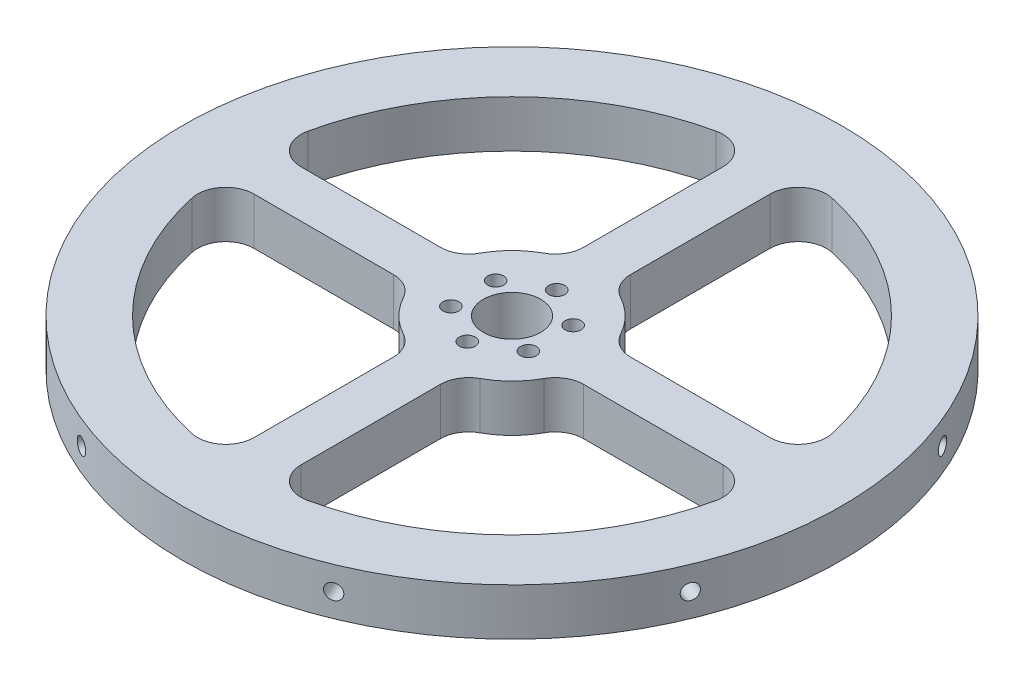
from build123d import *

# Parameters (mm, degrees)
SKETCH2_R           = 70
BOSS_EXTRUDE1_DEPTH = 5
CUT_EXTRUDE1_DEPTH  = 10
SKETCH6_R           = 6.1
CUT_EXTRUDE3_DEPTH  = 100.498743711
SKETCH7_R           = 1.7
CUT_EXTRUDE4_DEPTH  = 100.498743711
FILLET1_R           = 6
SKETCH10_R          = 1.65
CUT_EXTRUDE5_DEPTH  = 10
CIRPATTERN2_COUNT   = 8


with BuildPart() as part:
    # Sketch2 → Boss-Extrude1 (new, symmetric)
    with BuildSketch(Plane(origin=(0, 0, 0), x_dir=(1, 0, 0), z_dir=(0, 1, 0))):
        Circle(SKETCH2_R)
    extrude(amount=BOSS_EXTRUDE1_DEPTH, both=True)

    # Sketch3 → Cut-Extrude1 (cut)
    with BuildSketch(Plane(origin=(0, 5, 0), x_dir=(1, 0, 0), z_dir=(0, 1, 0))):
        with BuildLine():
            Line((5, -16.248076809), (5, -56.780278266))
            ThreePointArc((5, -56.780278266), (40.305086528, -40.305086528), (56.780278266, -5))
            Line((56.780278266, -5), (16.248076809, -5))
            ThreePointArc((16.248076809, -5), (12.02081528, -12.02081528), (5, -16.248076809))
        make_face()
        with BuildLine():
            ThreePointArc((-56.780278266, -5), (-40.305086528, -40.305086528), (-5, -56.780278266))
            Line((-5, -56.780278266), (-5, -16.248076809))
            ThreePointArc((-5, -16.248076809), (-12.02081528, -12.02081528), (-16.248076809, -5))
            Line((-16.248076809, -5), (-56.780278266, -5))
        make_face()
        with BuildLine():
            Line((16.248076809, 5), (56.780278266, 5))
            ThreePointArc((56.780278266, 5), (40.305086528, 40.305086528), (5, 56.780278266))
            Line((5, 56.780278266), (5, 16.248076809))
            ThreePointArc((5, 16.248076809), (12.02081528, 12.02081528), (16.248076809, 5))
        make_face()
        with BuildLine():
            Line((-56.780278266, 5), (-16.248076809, 5))
            ThreePointArc((-16.248076809, 5), (-12.02081528, 12.02081528), (-5, 16.248076809))
            Line((-5, 16.248076809), (-5, 56.780278266))
            ThreePointArc((-5, 56.780278266), (-40.305086528, 40.305086528), (-56.780278266, 5))
        make_face()
    extrude(amount=-CUT_EXTRUDE1_DEPTH, mode=Mode.SUBTRACT)

    # Sketch6 → Cut-Extrude3 (cut, through all)
    with BuildSketch(Plane(origin=(0, 5, 0), x_dir=(1, 0, 0), z_dir=(0, 1, 0))):
        Circle(SKETCH6_R)
    extrude(amount=-CUT_EXTRUDE3_DEPTH, mode=Mode.SUBTRACT)

    # Sketch7 → Cut-Extrude4 (cut, through all)
    with BuildSketch(Plane(origin=(0, 5, 0), x_dir=(1, 0, 0), z_dir=(0, 1, 0))):
        with Locations((0, 9.5)):
            Circle(SKETCH7_R)
        with Locations((8.227241336, 4.75)):
            Circle(SKETCH7_R)
        with Locations((8.227241336, -4.75)):
            Circle(SKETCH7_R)
        with Locations((0, -9.5)):
            Circle(SKETCH7_R)
        with Locations((-8.227241336, -4.75)):
            Circle(SKETCH7_R)
        with Locations((-8.227241336, 4.75)):
            Circle(SKETCH7_R)
    extrude(amount=-CUT_EXTRUDE4_DEPTH, mode=Mode.SUBTRACT)

    # Fillet1
    fillet1_edges = [part.edges().sort_by_distance(p)[0] for p in [
        (16.248076809, 0, 5),
        (56.780278266, 0, 5),
        (56.780278266, 0, -5),
        (16.248076809, 0, -5),
        (5, 0, -16.248076809),
        (5, 0, -56.780278266),
        (-5, 0, -56.780278266),
        (-5, 0, -16.248076809),
        (-16.248076809, 0, -5),
        (-56.780278266, 0, -5),
        (-56.780278266, 0, 5),
        (-16.248076809, 0, 5),
        (-5, 0, 16.248076809),
        (-5, 0, 56.780278266),
        (5, 0, 56.780278266),
        (5, 0, 16.248076809),
    ]]
    fillet(fillet1_edges, radius=FILLET1_R)

    # Sketch10 → Cut-Extrude5 (cut)
    with BuildSketch(Plane(origin=(64.671567276, 0, -26.787840266), x_dir=(-0.38268343236509067, 0, -0.9238795325112864), z_dir=(0.9238795325112864, 0, -0.38268343236509067))):
        Circle(SKETCH10_R)
    cut_extrude5 = extrude(amount=-CUT_EXTRUDE5_DEPTH, mode=Mode.SUBTRACT)

    # CirPattern2: Cut-Extrude5 ×8 about axis
    cirpattern2_axis = Axis((0, 5, 0), (0, -1, 0))
    for i in range(1, CIRPATTERN2_COUNT):
        add(cut_extrude5.rotate(cirpattern2_axis, i * 360 / CIRPATTERN2_COUNT), mode=Mode.SUBTRACT)


solid = part.part
